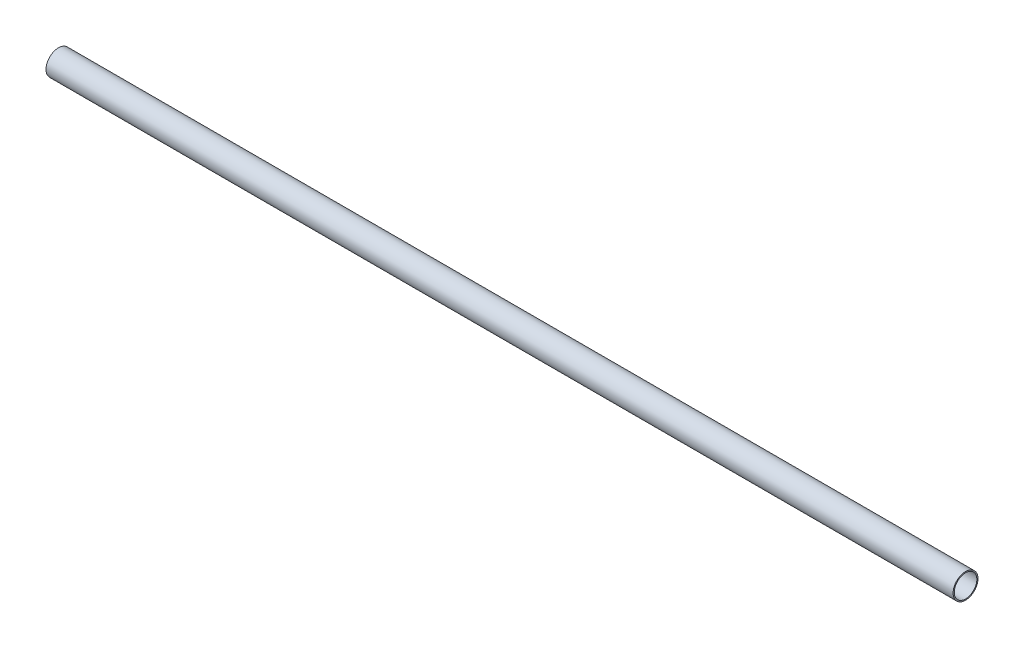
from build123d import *

# Parameters (mm, degrees)
SKETCH1_R           = 9.525
SKETCH1_R_2         = 8.636
BOSS_EXTRUDE1_DEPTH = 693.584603001


with BuildPart() as part:
    # Sketch1 → Boss-Extrude1 (new body)
    with BuildSketch(Plane(origin=(0, 0, 0), x_dir=(0, 0, -1), z_dir=(1, 0, 0))):
        with Locations(Location((0, 0, 0), (0, 0, 181.78083))):
            Circle(SKETCH1_R)
        with Locations(Location((0, 0, 0), (0, 0, 181.78083))):
            Circle(SKETCH1_R_2, mode=Mode.SUBTRACT)
    extrude(amount=BOSS_EXTRUDE1_DEPTH)


solid = part.part
